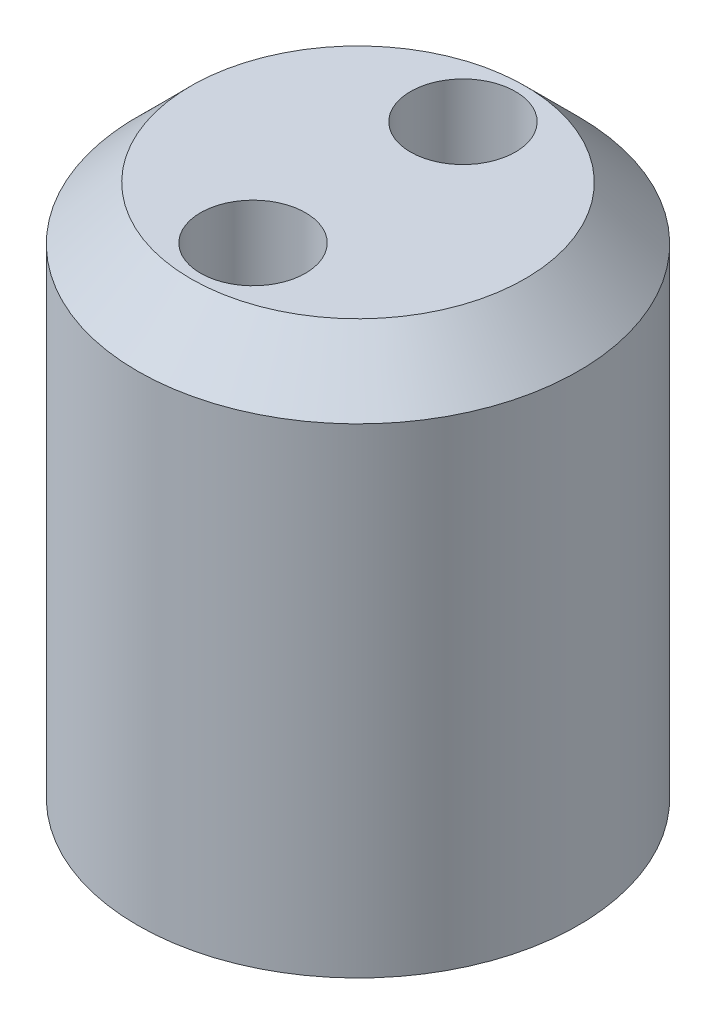
from build123d import *

# Parameters (mm, degrees)
SKETCH1_R           = 10.499999955
SKETCH1_R_2         = 2.5
BOSS_EXTRUDE1_DEPTH = 25.4
CHAMFER1_SIZE       = 2.54


with BuildPart() as part:
    # Sketch1 → Boss-Extrude1 (new body)
    with BuildSketch(Plane(origin=(0, 0, 0), x_dir=(1, 0, 0), z_dir=(0, 1, 0))):
        with Locations(Location((0, 0, 0), (0, 0, 270))):
            Circle(SKETCH1_R)
        with Locations(Location((0, 5, 0), (0, 0, 270))):
            Circle(SKETCH1_R_2, mode=Mode.SUBTRACT)
        with Locations(Location((0, -5, 0), (0, 0, 270))):
            Circle(SKETCH1_R_2, mode=Mode.SUBTRACT)
    extrude(amount=BOSS_EXTRUDE1_DEPTH)

    # Chamfer1
    chamfer1_edges = [part.edges().sort_by_distance(p)[0] for p in [
        (0, 25.4, -10.499999955),
    ]]
    chamfer(chamfer1_edges, length=CHAMFER1_SIZE)


solid = part.part
